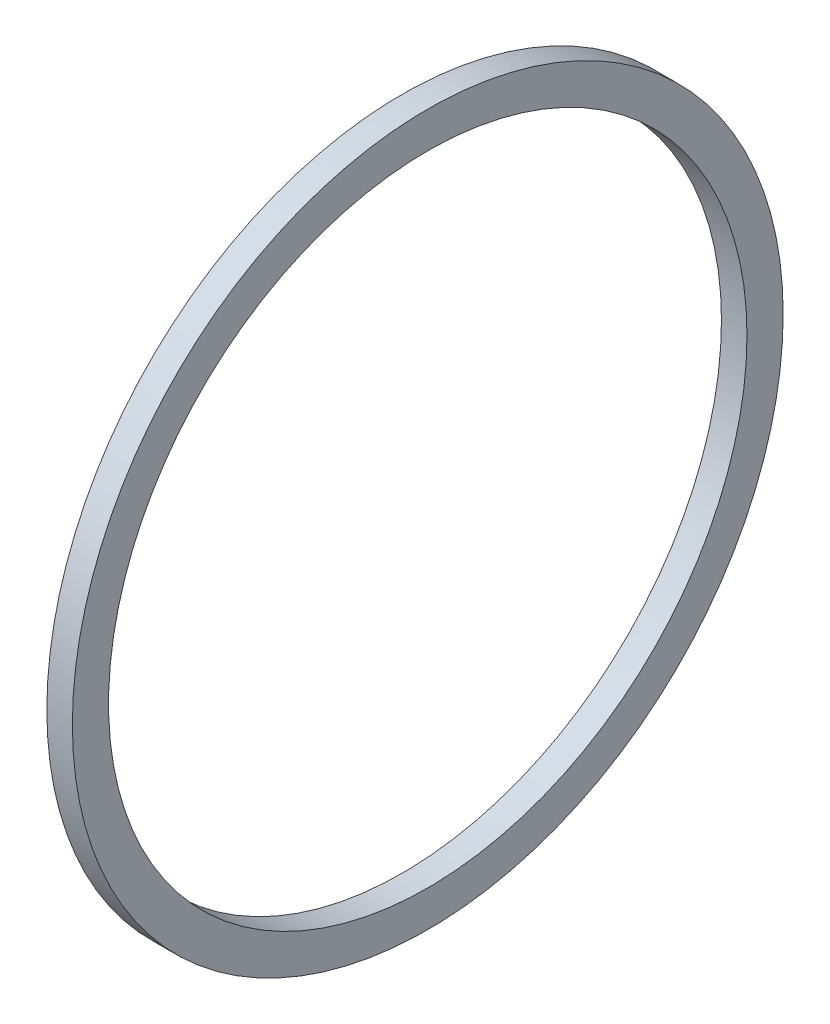
from build123d import *

# Parameters (mm, degrees)
SKETCH1_R           = 16.7
SKETCH1_R_2         = 15
BOSS_EXTRUDE1_DEPTH = 1.2


with BuildPart() as part:
    # Sketch1 → Boss-Extrude1 (new body)
    with BuildSketch(Plane(origin=(0, 0, 0), x_dir=(0, 0, -1), z_dir=(1, 0, 0))):
        Circle(SKETCH1_R)
        Circle(SKETCH1_R_2, mode=Mode.SUBTRACT)
    extrude(amount=BOSS_EXTRUDE1_DEPTH)


solid = part.part
